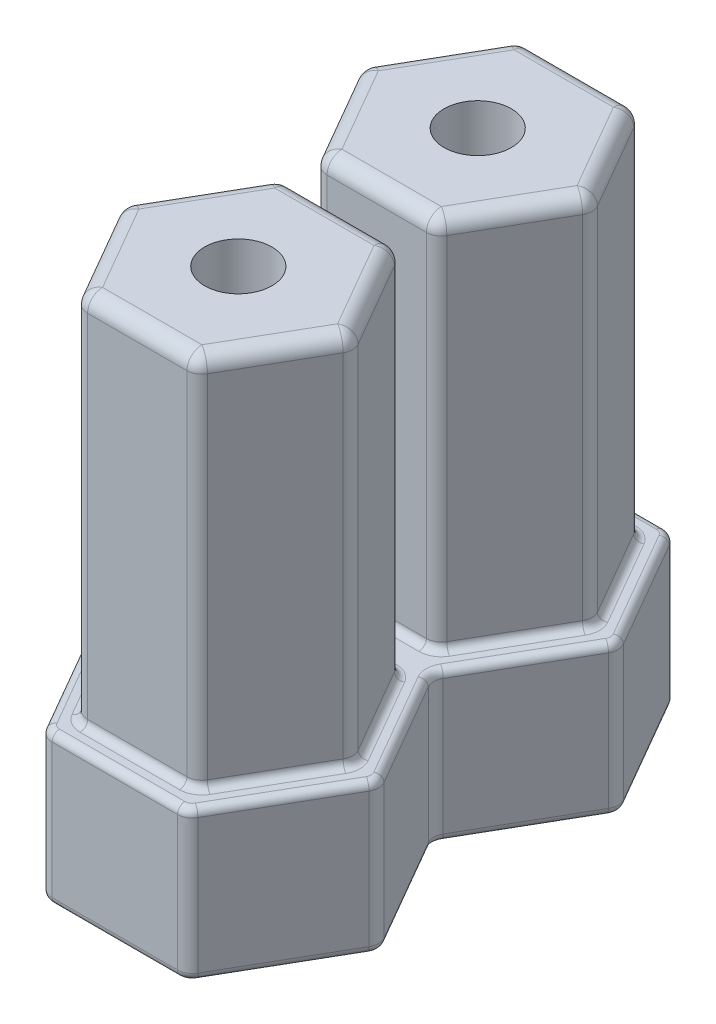
from build123d import *

# Parameters (mm, degrees)
BOSS_EXTRUDE1_DEPTH                      = 25
BOSS_EXTRUDE1_2_DEPTH                    = 25
BOSS_EXTRUDE2_DEPTH                      = 10
FILLET1_R                                = 1
CBORE_FOR_M4_PAN_HEAD_SCREW1_D           = 4.5
CBORE_FOR_M4_PAN_HEAD_SCREW1_CBORE_D     = 9
CBORE_FOR_M4_PAN_HEAD_SCREW1_CBORE_DEPTH = 5
FILLET2_R                                = 0.5
FILLET3_R                                = 0.5


with BuildPart() as part:
    # Sketch1 → Boss-Extrude1 (new body)
    with BuildSketch(Plane(origin=(0, 0, 0), x_dir=(1, 0, 0), z_dir=(0, 1, 0))):
        Polygon((-3.897114317, -6.75), (3.897114317, -6.75), (7.794228634, 0), (3.897114317, 6.75), (-3.897114317, 6.75), (-7.794228634, 0), align=None)
    extrude(amount=BOSS_EXTRUDE1_DEPTH)



with BuildPart() as body_2:
    # Sketch1 → Boss-Extrude1 2 (new body)
    with BuildSketch(Plane(origin=(0, 0, 0), x_dir=(1, 0, 0), z_dir=(0, 1, 0))):
        Polygon((-3.897114317, 9.25), (3.897114317, 9.25), (7.794228634, 16), (3.897114317, 22.75), (-3.897114317, 22.75), (-7.794228634, 16), align=None)
    extrude(amount=BOSS_EXTRUDE1_2_DEPTH)


with BuildPart() as part_1:
    add(part.part)

    add(body_2.part)  # Boss-Extrude2 merges body 2
    # Sketch1<3> → Boss-Extrude2 (add)
    with BuildSketch(Plane(origin=(0, 0, 0), x_dir=(1, 0, 0), z_dir=(0, 1, 0))):
        Polygon((9.526279442, 0), (4.907477288, 8), (9.526279442, 16), (4.763139721, 24.25), (-4.763139721, 24.25), (-9.526279442, 16), (-4.907477288, 8), (-9.526279442, 0), (-4.763139721, -8.25), (4.763139721, -8.25), align=None)
    extrude(amount=-BOSS_EXTRUDE2_DEPTH)

    # Fillet1
    fillet1_edges = [part_1.edges().sort_by_distance(p)[0] for p in [
        (-5.845671476, 25, -3.375),
        (0, 25, -6.75),
        (5.845671476, 25, -3.375),
        (5.845671476, 25, 3.375),
        (0, 25, 6.75),
        (-5.845671476, 25, 3.375),
        (-5.845671476, 25, -19.375),
        (0, 25, -22.75),
        (5.845671476, 25, -19.375),
        (5.845671476, 25, -12.625),
        (0, 25, -9.25),
        (-5.845671476, 25, -12.625),
        (4.763139721, -5, 8.25),
        (9.526279442, -5, 0),
        (4.907477288, -5, -8),
        (9.526279442, -5, -16),
        (4.763139721, -5, -24.25),
        (-4.763139721, -5, -24.25),
        (-9.526279442, -5, -16),
        (-4.907477288, -5, -8),
        (-9.526279442, -5, 0),
        (-4.763139721, -5, 8.25),
        (7.794228634, 12.5, -16),
        (3.897114317, 12.5, -22.75),
        (-3.897114317, 12.5, -22.75),
        (-7.794228634, 12.5, -16),
        (-3.897114317, 12.5, -9.25),
        (3.897114317, 12.5, -9.25),
        (3.897114317, 12.5, -6.75),
        (-3.897114317, 12.5, -6.75),
        (-7.794228634, 12.5, 0),
        (-3.897114317, 12.5, 6.75),
        (3.897114317, 12.5, 6.75),
        (7.794228634, 12.5, 0),
    ]]
    fillet(fillet1_edges, radius=FILLET1_R)

    # CBORE for M4 Pan Head Screw1 (through all)
    with Locations(Plane.XZ.offset(10)):
        with Locations((0, 0), (0, -16)):
            CounterBoreHole(CBORE_FOR_M4_PAN_HEAD_SCREW1_D / 2, CBORE_FOR_M4_PAN_HEAD_SCREW1_CBORE_D / 2, CBORE_FOR_M4_PAN_HEAD_SCREW1_CBORE_DEPTH)

    # Fillet2
    fillet2_edges = [part_1.edges().sort_by_distance(p)[0] for p in [
        (9.371578903, -10, 0),
        (7.216878365, -10, -4),
        (5.062177826, -10, -8),
        (7.216878365, -10, -12),
        (9.371578903, -10, -16),
        (7.144709581, -10, -20.125),
        (4.685789452, -10, -24.116025404),
        (0, -10, -24.25),
        (-4.685789452, -10, -24.116025404),
        (-7.144709581, -10, -20.125),
        (-9.371578903, -10, -16),
        (-7.216878365, -10, -12),
        (-5.062177826, -10, -8),
        (-7.216878365, -10, -4),
        (-9.371578903, -10, 0),
        (-7.144709581, -10, 4.125),
        (-4.685789452, -10, 8.116025404),
        (0, -10, 8.25),
        (4.685789452, -10, 8.116025404),
        (7.144709581, -10, 4.125),
        (-4.5, -10, -16),
        (-4.5, -10, 0),
    ]]
    fillet(fillet2_edges, radius=FILLET2_R)

    # Fillet3
    fillet3_edges = [part_1.edges().sort_by_distance(p)[0] for p in [
        (-3.819764048, 0, -6.616025404),
        (0, 0, -6.75),
        (3.819764048, 0, -6.616025404),
        (5.845671476, 0, -3.375),
        (7.639528096, 0, 0),
        (5.845671476, 0, 3.375),
        (3.819764048, 0, 6.616025404),
        (0, 0, 6.75),
        (-3.819764048, 0, 6.616025404),
        (-5.845671476, 0, 3.375),
        (-7.639528096, 0, 0),
        (-7.639528096, 0, -16),
        (-5.845671476, 0, -19.375),
        (-3.819764048, 0, -22.616025404),
        (0, 0, -22.75),
        (3.819764048, 0, -22.616025404),
        (5.845671476, 0, -19.375),
        (7.639528096, 0, -16),
        (5.845671476, 0, -12.625),
        (3.819764048, 0, -9.383974596),
        (0, 0, -9.25),
        (-3.819764048, 0, -9.383974596),
        (-5.845671476, 0, -3.375),
        (-5.845671476, 0, -12.625),
        (-4.685789452, 0, 8.116025404),
        (-7.144709581, 0, 4.125),
        (-9.371578903, 0, 0),
        (-7.216878365, 0, -4),
        (-5.062177826, 0, -8),
        (-7.216878365, 0, -12),
        (-9.371578903, 0, -16),
        (-7.144709581, 0, -20.125),
        (-4.685789452, 0, -24.116025404),
        (0, 0, -24.25),
        (4.685789452, 0, -24.116025404),
        (7.144709581, 0, -20.125),
        (9.371578903, 0, -16),
        (7.216878365, 0, -12),
        (5.062177826, 0, -8),
        (7.216878365, 0, -4),
        (9.371578903, 0, 0),
        (7.144709581, 0, 4.125),
        (4.685789452, 0, 8.116025404),
        (0, 0, 8.25),
    ]]
    fillet(fillet3_edges, radius=FILLET3_R)


solid = part_1.part
